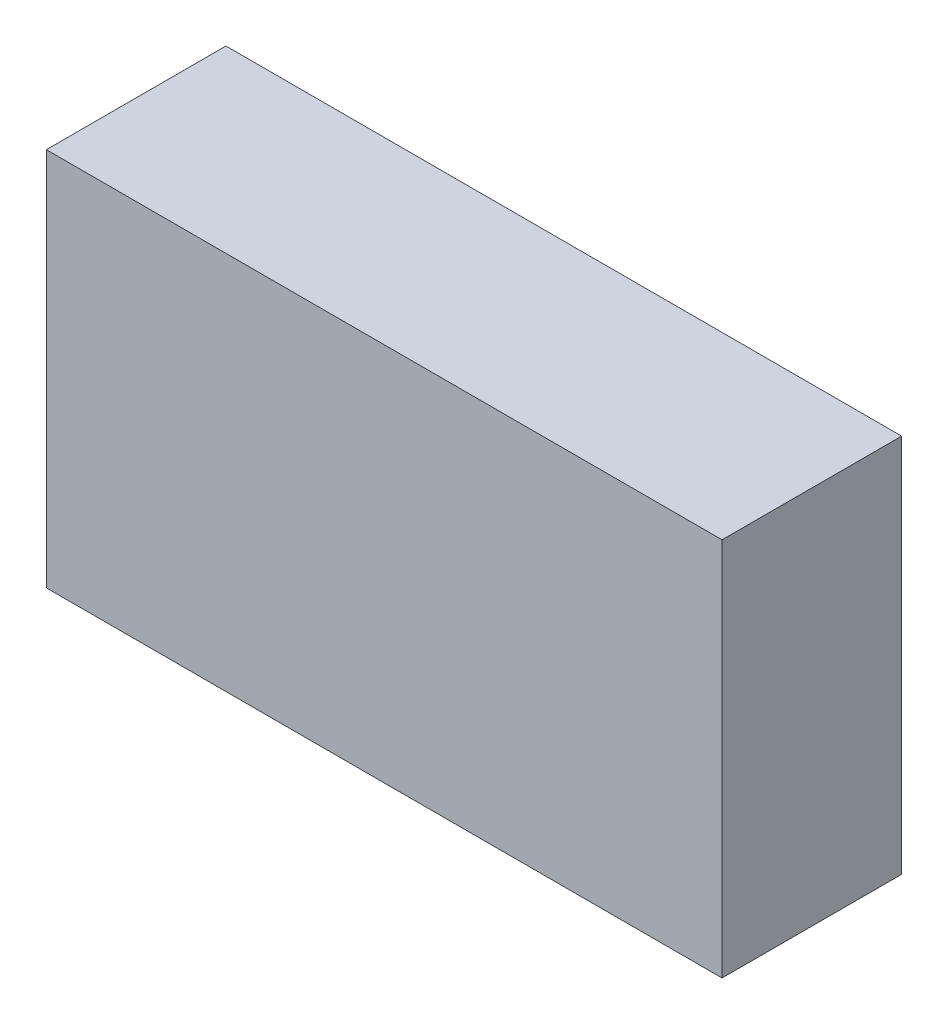
from build123d import *

# Parameters (mm, degrees)
SKETCH1_W           = 36.5
SKETCH1_H           = 20.5
BOSS_EXTRUDE1_DEPTH = 9.7


with BuildPart() as part:
    # Sketch1 → Boss-Extrude1 (new body)
    with BuildSketch(Plane.XY):
        with Locations((18.25, 10.25)):
            Rectangle(SKETCH1_W, SKETCH1_H)
    extrude(amount=BOSS_EXTRUDE1_DEPTH)


solid = part.part
